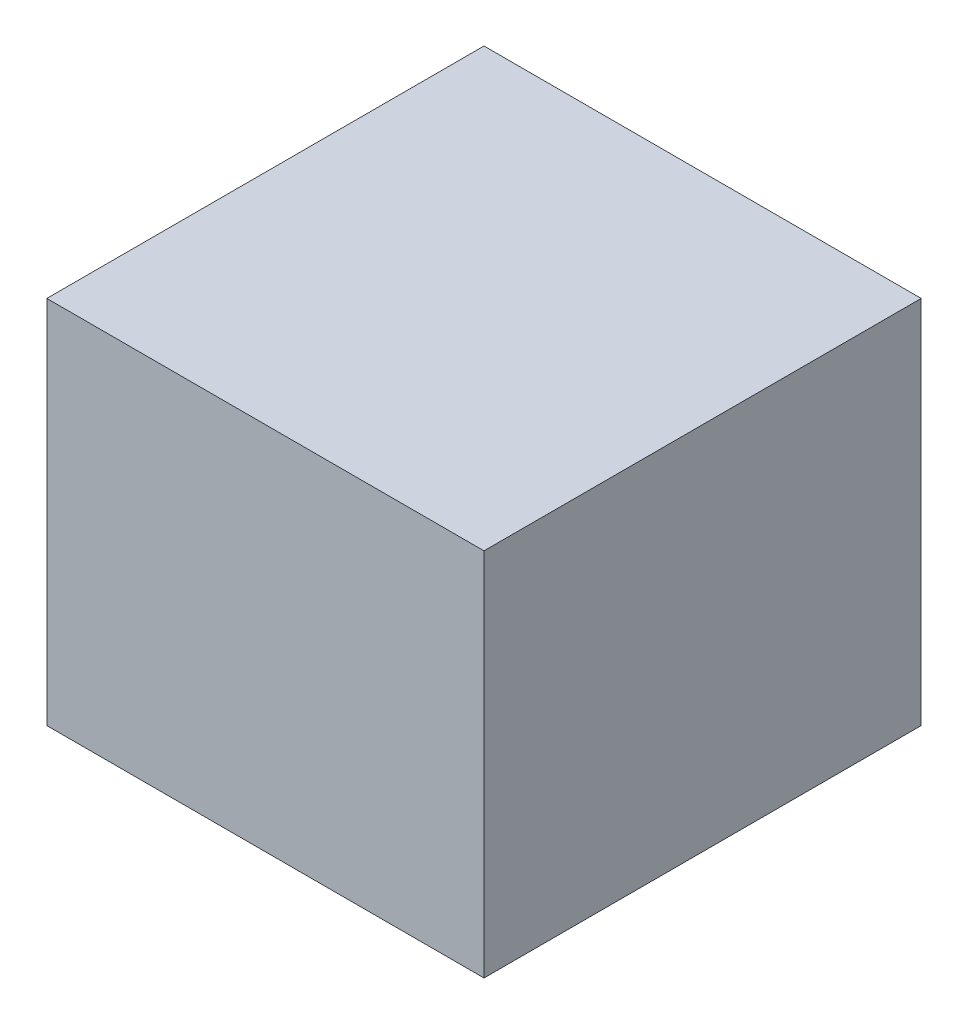
from build123d import *

# Parameters (mm, degrees)
SKETCH2_W           = 330.2
SKETCH2_H           = 330.2
BOSS_EXTRUDE1_DEPTH = 279.4


with BuildPart() as part:
    # Sketch2 → Boss-Extrude1 (new body)
    with BuildSketch(Plane(origin=(0, 0, 0), x_dir=(1, 0, 0), z_dir=(0, 1, 0))):
        Rectangle(SKETCH2_W, SKETCH2_H)
    extrude(amount=BOSS_EXTRUDE1_DEPTH)


solid = part.part
